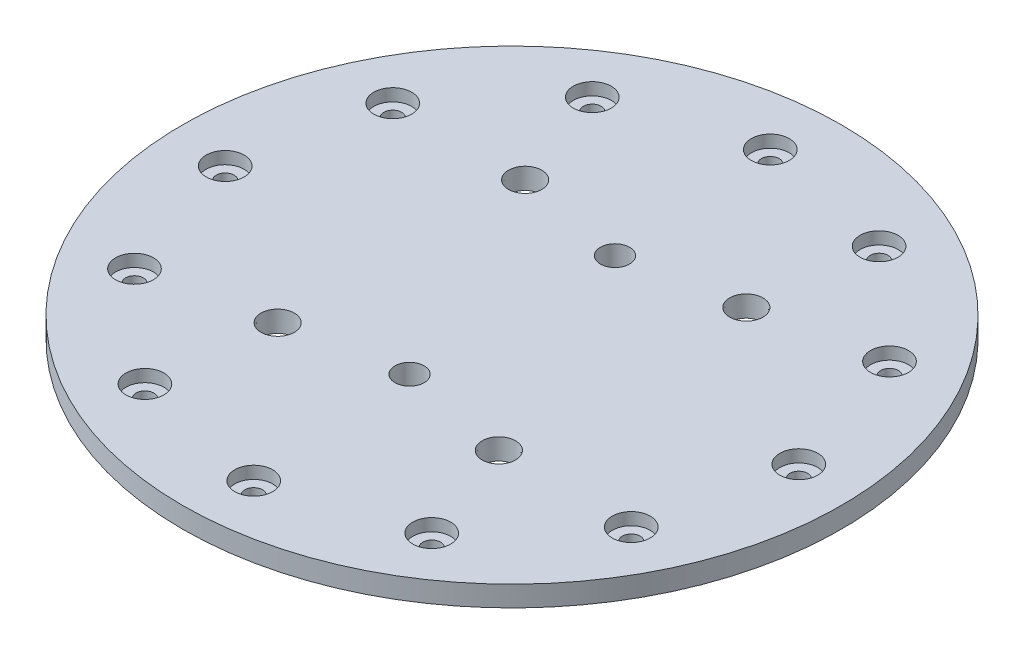
from build123d import *

# Parameters (mm, degrees)
SKETCH1_R                                        = 101.6
SKETCH1_R_2                                      = 0.254
BOSS_EXTRUDE1_DEPTH                              = 6.35
CBORE_FOR_M5_HEX_HEAD_MACHINE_SCREW1_D           = 5.5
CBORE_FOR_M5_HEX_HEAD_MACHINE_SCREW1_CBORE_D     = 11.71
CBORE_FOR_M5_HEX_HEAD_MACHINE_SCREW1_CBORE_DEPTH = 3.8
CIRPATTERN1_COUNT                                = 12
F_1_8_NPT_TAPPED_HOLE1_AT_2_COUNT                = 2
F_1_8_NPT_TAPPED_HOLE1_AT_2_PITCH                = 68.188989136
F_1_8_NPT_TAPPED_HOLE1_AT_3_COUNT                = 2
F_1_8_NPT_TAPPED_HOLE1_AT_3_PITCH                = 102.325089279
F_1_8_NPT_TAPPED_HOLE1_AT_4_COUNT                = 2
F_1_8_NPT_TAPPED_HOLE1_AT_4_PITCH                = 76.293418173
M10X1_0_TAPPED_HOLE1_D                           = 9
M10X1_0_TAPPED_HOLE1_DEPTH                       = 25.146
M10X1_0_TAPPED_HOLE1_TIP                         = 2.703872786


with BuildPart() as part:
    # Sketch1 → Boss-Extrude1 (new body)
    with BuildSketch(Plane(origin=(0, 0, 0), x_dir=(1, 0, 0), z_dir=(0, 1, 0))):
        with Locations(Location((0, 0, 0), (0, 0, 270))):
            Circle(SKETCH1_R)
        with Locations(Location((-74.964980341, 38.201709762, 0), (0, 0, 270))):
            Circle(SKETCH1_R_2, mode=Mode.SUBTRACT)
    extrude(amount=BOSS_EXTRUDE1_DEPTH)

    # CBORE for M5 Hex Head Machine Screw1 (through all)
    with Locations(Plane(origin=(0, 6.35, 0), x_dir=(1, 0, 0), z_dir=(0, 1, 0))):
        with Locations((-74.964980341, 38.201709762)):
            cbore_for_m5_hex_head_machine_screw1 = CounterBoreHole(CBORE_FOR_M5_HEX_HEAD_MACHINE_SCREW1_D / 2, CBORE_FOR_M5_HEX_HEAD_MACHINE_SCREW1_CBORE_D / 2, CBORE_FOR_M5_HEX_HEAD_MACHINE_SCREW1_CBORE_DEPTH)

    # CirPattern1: CBORE for M5 Hex Head Machine Screw1 ×12 about axis
    cirpattern1_axis = Axis((0, 0, 0), (0, 1, 0))
    for i in range(1, CIRPATTERN1_COUNT):
        add(cbore_for_m5_hex_head_machine_screw1.rotate(cirpattern1_axis, i * 360 / CIRPATTERN1_COUNT), mode=Mode.SUBTRACT)

    # Sketch10 → 1/8 NPT Tapped Hole1 (revolve, cut)
    with BuildSketch(Plane(origin=(-34.094494568, 6.35, -38.146709086), x_dir=(0, 0, 1), z_dir=(1, 0, 0))):
        Polygon((0, 0), (0, 6.35), (4.2164, 6.35), (4.2164, 6.858), (4.936181096, 6.858), (5.1415188, 0), align=None)
    f_1_8_npt_tapped_hole1 = revolve(axis=Axis((-34.094494568, 12.7, -38.146709086), (0, -1, 0)), mode=Mode.SUBTRACT)

    # 1/8 NPT Tapped Hole1 at 2: 1/8 NPT Tapped Hole1 ×2
    with Locations(*[(i * F_1_8_NPT_TAPPED_HOLE1_AT_2_PITCH, 0, 0) for i in range(1, F_1_8_NPT_TAPPED_HOLE1_AT_2_COUNT)]):
        add(f_1_8_npt_tapped_hole1, mode=Mode.SUBTRACT)

    # 1/8 NPT Tapped Hole1 at 3: 1/8 NPT Tapped Hole1 ×2
    with Locations(*[Vector(0.6663955987411356, 0, 0.7455983543292215) * (i * F_1_8_NPT_TAPPED_HOLE1_AT_3_PITCH) for i in range(1, F_1_8_NPT_TAPPED_HOLE1_AT_3_COUNT)]):
        add(f_1_8_npt_tapped_hole1, mode=Mode.SUBTRACT)

    # 1/8 NPT Tapped Hole1 at 4: 1/8 NPT Tapped Hole1 ×2
    with Locations(*[(0, 0, i * F_1_8_NPT_TAPPED_HOLE1_AT_4_PITCH) for i in range(1, F_1_8_NPT_TAPPED_HOLE1_AT_4_COUNT)]):
        add(f_1_8_npt_tapped_hole1, mode=Mode.SUBTRACT)

    # M10x1.0 Tapped Hole1
    with Locations(Plane(origin=(0, 6.35, -31.75), x_dir=(0, 0, 1), z_dir=(0, 1, 0))):
        with Locations((0, 0), (63.331589409, 0)):
            Hole(M10X1_0_TAPPED_HOLE1_D / 2, depth=M10X1_0_TAPPED_HOLE1_DEPTH)
            with Locations((0, 0, -(M10X1_0_TAPPED_HOLE1_DEPTH + M10X1_0_TAPPED_HOLE1_TIP / 2))):  # 118° drill point
                Cone(0, M10X1_0_TAPPED_HOLE1_D / 2, M10X1_0_TAPPED_HOLE1_TIP, mode=Mode.SUBTRACT)


solid = part.part
